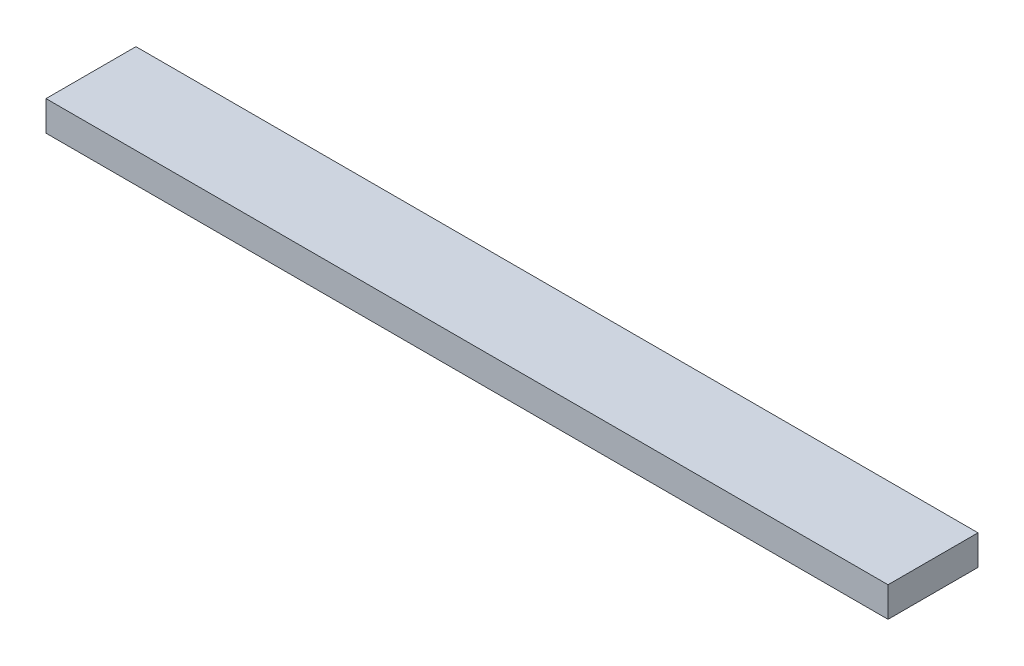
from build123d import *

# Parameters (mm, degrees)
SKETCH1_W           = 2808
SKETCH1_H           = 300
BOSS_EXTRUDE1_DEPTH = 100


with BuildPart() as part:
    # Sketch1 → Boss-Extrude1 (new body)
    with BuildSketch(Plane(origin=(0, 0, 0), x_dir=(1, 0, 0), z_dir=(0, 1, 0))):
        with Locations((1404, 150)):
            Rectangle(SKETCH1_W, SKETCH1_H)
    extrude(amount=BOSS_EXTRUDE1_DEPTH)


solid = part.part
